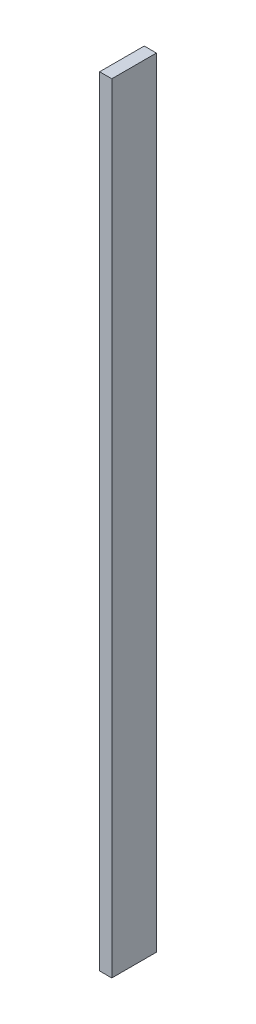
from build123d import *

# Parameters (mm, degrees)
SKETCH1_W           = 38.1
SKETCH1_H           = 139.7
BOSS_EXTRUDE1_DEPTH = 2438.4


with BuildPart() as part:
    # Sketch1 → Boss-Extrude1 (new body)
    with BuildSketch(Plane(origin=(0, 0, 0), x_dir=(1, 0, 0), z_dir=(0, 1, 0))):
        Rectangle(SKETCH1_W, SKETCH1_H)
    extrude(amount=BOSS_EXTRUDE1_DEPTH)


solid = part.part
